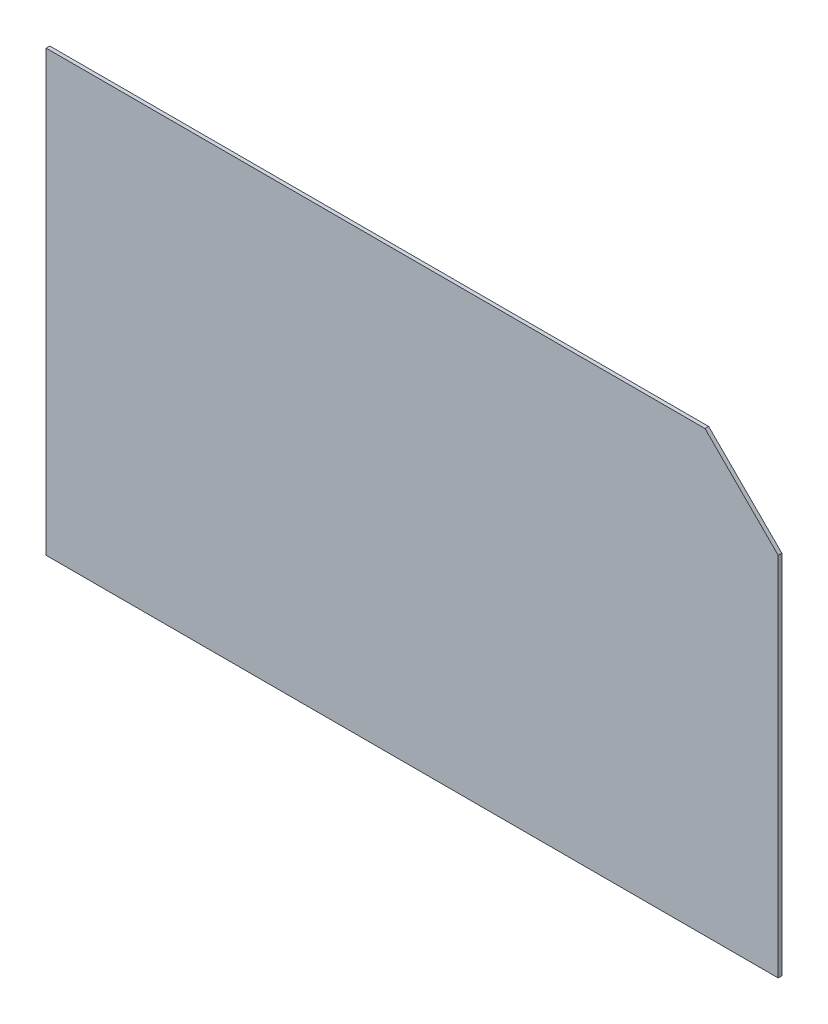
from build123d import *

# Parameters (mm, degrees)
SKETCH2_W           = 5000
SKETCH2_H           = 3000
BOSS_EXTRUDE1_DEPTH = 25
CUT_EXTRUDE1_DEPTH  = 932


with BuildPart() as part:
    # Sketch2 → Boss-Extrude1 (new body)
    with BuildSketch(Plane.XY):
        Rectangle(SKETCH2_W, SKETCH2_H)
    extrude(amount=-BOSS_EXTRUDE1_DEPTH)

    # Sketch3 → Cut-Extrude1 (cut)
    with BuildSketch(Plane.XY):
        Polygon((2500, 1000), (2500, 1500), (2000, 1500), align=None)
    extrude(amount=-CUT_EXTRUDE1_DEPTH, mode=Mode.SUBTRACT)


solid = part.part
